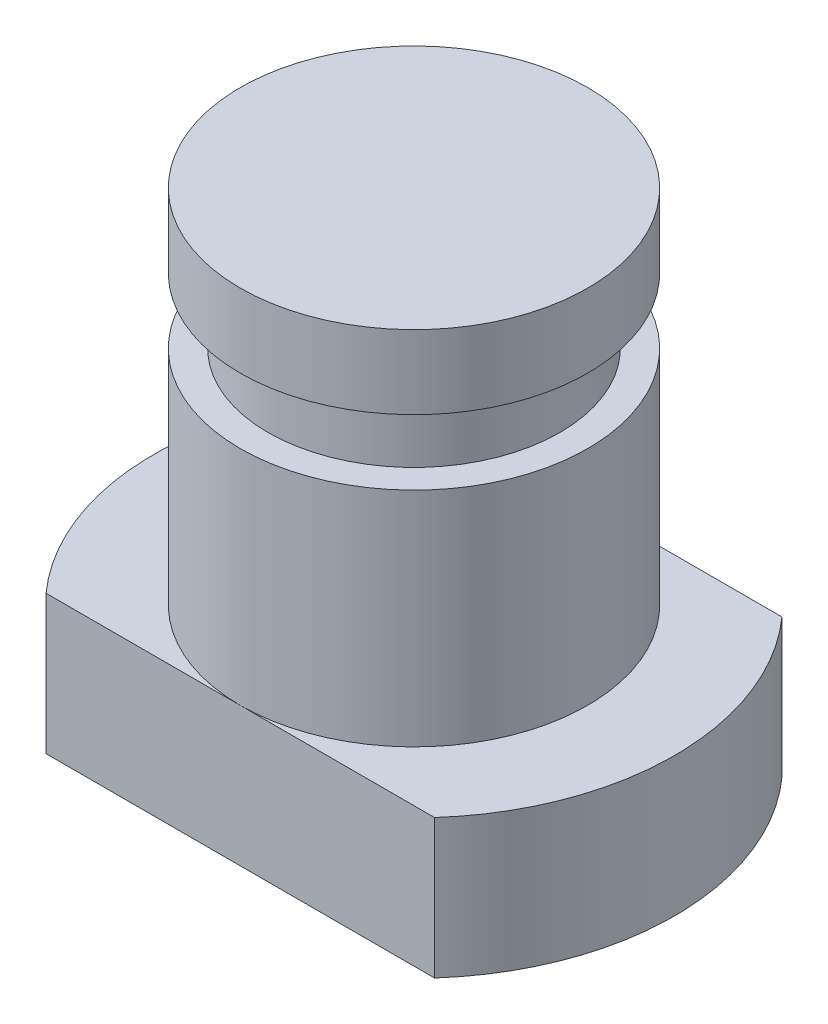
from build123d import *

# Parameters (mm, degrees)
SKETCH1_R           = 3.175
BOSS_EXTRUDE1_DEPTH = 6.604
BOSS_EXTRUDE2_DEPTH = 2.54
SKETCH6_OUTSIDE_W   = 14.455
SKETCH6_OUTSIDE_H   = 11.28
SKETCH6_OUTSIDE_R   = 2.667
CUT_EXTRUDE1_DEPTH  = 1.1938


with BuildPart() as part:
    # Sketch1 → Boss-Extrude1 (new body)
    with BuildSketch(Plane(origin=(0, 0, 0), x_dir=(1, 0, 0), z_dir=(0, 1, 0))):
        with Locations(Location((0, 0, 0), (0, 0, 90))):
            Circle(SKETCH1_R)
    extrude(amount=BOSS_EXTRUDE1_DEPTH)

    # Sketch2 → Boss-Extrude2 (add)
    with BuildSketch(Plane.XZ):
        with BuildLine():
            Line((-3.549757914, 3.175), (3.549757914, 3.175))
            ThreePointArc((3.549757914, 3.175), (4.7625, 0), (3.549757914, -3.175))
            Line((3.549757914, -3.175), (-3.549757914, -3.175))
            ThreePointArc((-3.549757914, -3.175), (-4.7625, 0), (-3.549757914, 3.175))
        make_face()
    extrude(amount=BOSS_EXTRUDE2_DEPTH)

    # Sketch6 outside → Cut-Extrude1 (cut)
    with BuildSketch(Plane(origin=(0, 4.064, 0), x_dir=(1, 0, 0), z_dir=(0, 1, 0))):
        with Locations((0.0005, 0)):
            Rectangle(SKETCH6_OUTSIDE_W, SKETCH6_OUTSIDE_H)
        with Locations(Location((0, 0, 0), (0, 0, 270))):
            Circle(SKETCH6_OUTSIDE_R, mode=Mode.SUBTRACT)
    extrude(amount=CUT_EXTRUDE1_DEPTH, mode=Mode.SUBTRACT)


solid = part.part
